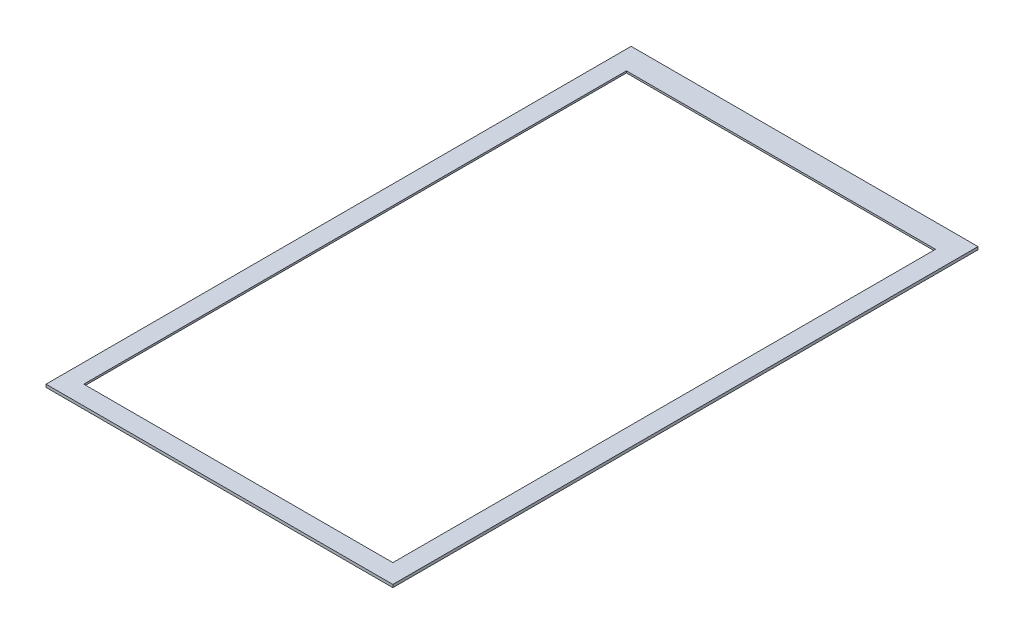
from build123d import *

# Parameters (mm, degrees)
SKETCH1_W           = 735
SKETCH1_H           = 1240
SKETCH1_W_2         = 655
SKETCH1_H_2         = 1150
BOSS_EXTRUDE1_DEPTH = 6
SKETCH2_W           = 697
SKETCH2_H           = 1192
CUT_EXTRUDE1_DEPTH  = 2


with BuildPart() as part:
    # Sketch1 → Boss-Extrude1 (new body)
    with BuildSketch(Plane(origin=(0, 0, 0), x_dir=(1, 0, 0), z_dir=(0, 1, 0))):
        Rectangle(SKETCH1_W, SKETCH1_H)
        with Locations((0, -5)):
            Rectangle(SKETCH1_W_2, SKETCH1_H_2, mode=Mode.SUBTRACT)
    extrude(amount=BOSS_EXTRUDE1_DEPTH)

    # Sketch2 → Cut-Extrude1 (cut)
    with BuildSketch(Plane.XZ):
        with Locations((0, 5)):
            Rectangle(SKETCH2_W, SKETCH2_H)
    extrude(amount=-CUT_EXTRUDE1_DEPTH, mode=Mode.SUBTRACT)


solid = part.part
